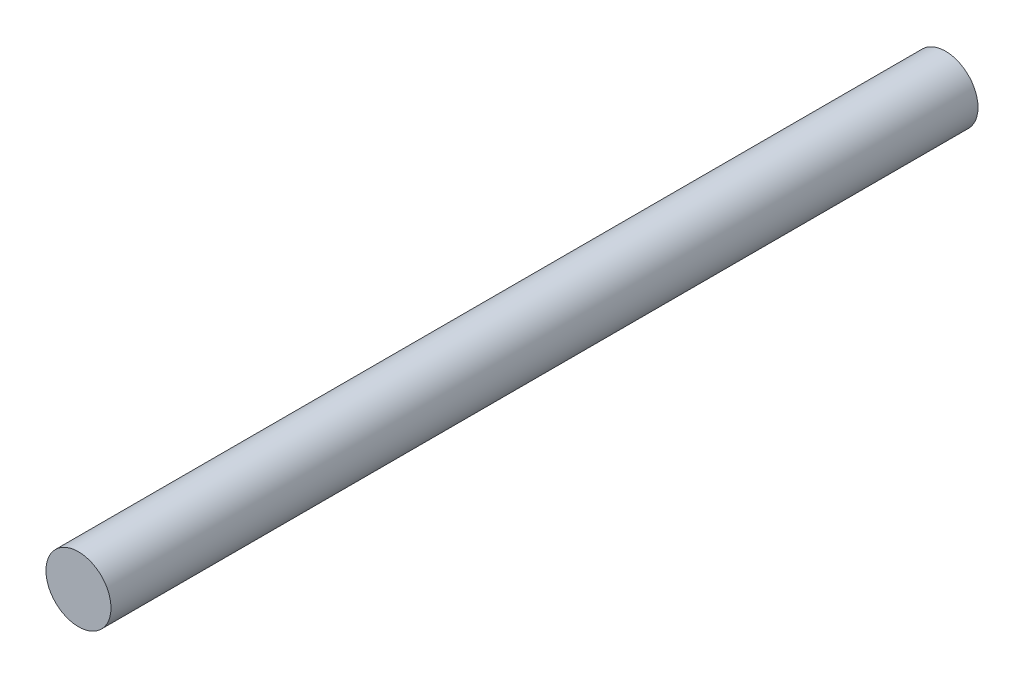
from build123d import *

# Parameters (mm, degrees)
SKETCH1_R           = 9.525
BOSS_EXTRUDE2_DEPTH = 127


with BuildPart() as part:
    # Sketch1 → Boss-Extrude2 (new, symmetric)
    with BuildSketch(Plane.XY):
        Circle(SKETCH1_R)
    extrude(amount=BOSS_EXTRUDE2_DEPTH, both=True)


solid = part.part
